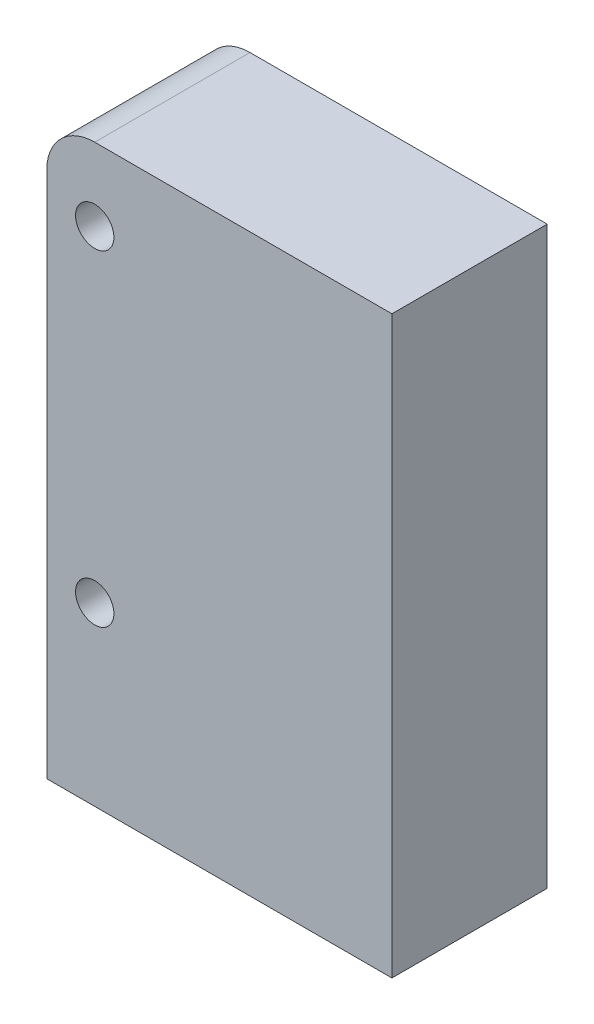
from build123d import *

# Parameters (mm, degrees)
ESQUISSE1_W             = 18
ESQUISSE1_H             = 30
BOSS_EXTRU_1_DEPTH      = 8.1
ESQUISSE3_R             = 1
ENL_V_MAT_EXTRU_1_DEPTH = 36.911140333
CONG_1_R                = 2.5


with BuildPart() as part:
    # Esquisse1 → Boss.-Extru.1 (new body)
    with BuildSketch(Plane.XY):
        with Locations((9, 15)):
            Rectangle(ESQUISSE1_W, ESQUISSE1_H)
    extrude(amount=BOSS_EXTRU_1_DEPTH)

    # Esquisse3 → Enlèv. mat.-Extru.1 (cut, through all)
    with BuildSketch(Plane.XY.offset(8.1)):
        with Locations((2.5, 26.2)):
            Circle(ESQUISSE3_R)
        with Locations((2.5, 9.2)):
            Circle(ESQUISSE3_R)
    extrude(amount=-ENL_V_MAT_EXTRU_1_DEPTH, mode=Mode.SUBTRACT)

    # Congé1
    cong_1_edges = [part.edges().sort_by_distance(p)[0] for p in [
        (0, 30, 4.05),
    ]]
    fillet(cong_1_edges, radius=CONG_1_R)


solid = part.part
